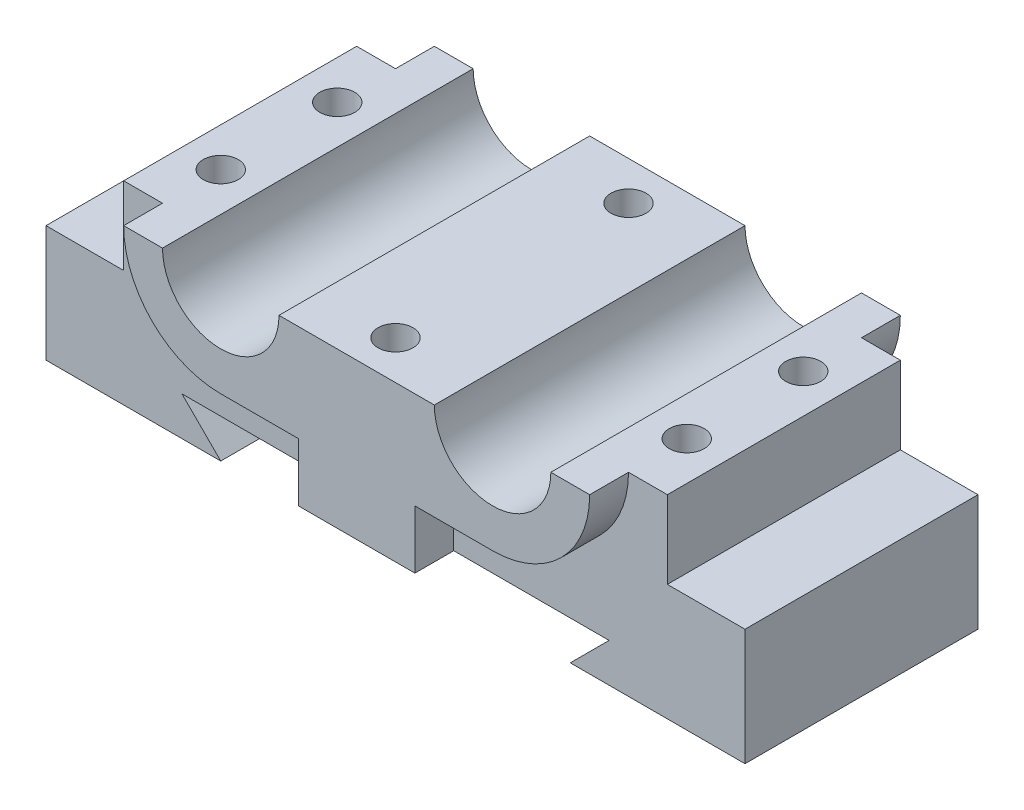
from build123d import *

# Parameters (mm, degrees)
SKETCH1_W           = 90
SKETCH1_H           = 40
BOSS_EXTRUDE1_DEPTH = 25
CUT_EXTRUDE1_REACH  = 67.192
SKETCH2_R           = 7.5
SKETCH2_W           = 10
SKETCH2_H           = 10
CUT_EXTRUDE2_DEPTH  = 5
CUT_EXTRUDE3_DEPTH  = 66.192024052
SKETCH5_R           = 2.25
CUT_EXTRUDE4_DEPTH  = 15


with BuildPart() as part:
    # Sketch1 → Boss-Extrude1 (new body)
    with BuildSketch(Plane(origin=(0, 0, 0), x_dir=(1, 0, 0), z_dir=(0, 1, 0))):
        Rectangle(SKETCH1_W, SKETCH1_H)
    extrude(amount=BOSS_EXTRUDE1_DEPTH)

    # Sketch2 → Cut-Extrude1 (cut, up to next)
    with BuildSketch(Plane.XY.offset(20), mode=Mode.PRIVATE) as cut_extrude1_sk1:
        with Locations((-17.5, 25)):
            Circle(SKETCH2_R)
    cut_extrude1_tool1 = extrude(cut_extrude1_sk1.sketch, amount=-CUT_EXTRUDE1_REACH, mode=Mode.PRIVATE) & part.part
    # Sketch2 → Cut-Extrude1 (cut, up to next)
    with BuildSketch(Plane.XY.offset(20), mode=Mode.PRIVATE) as cut_extrude1_sk2:
        with Locations((17.5, 25)):
            Circle(SKETCH2_R)
    cut_extrude1_tool2 = extrude(cut_extrude1_sk2.sketch, amount=-CUT_EXTRUDE1_REACH, mode=Mode.PRIVATE) & part.part
    # Sketch2 → Cut-Extrude1 (cut, up to next)
    with BuildSketch(Plane.XY.offset(20), mode=Mode.PRIVATE) as cut_extrude1_sk3:
        with Locations((40, 20)):
            Rectangle(SKETCH2_W, SKETCH2_H)
    cut_extrude1_tool3 = extrude(cut_extrude1_sk3.sketch, amount=-CUT_EXTRUDE1_REACH, mode=Mode.PRIVATE) & part.part
    # Sketch2 → Cut-Extrude1 (cut, up to next)
    with BuildSketch(Plane.XY.offset(20), mode=Mode.PRIVATE) as cut_extrude1_sk4:
        with Locations((-40, 20)):
            Rectangle(SKETCH2_W, SKETCH2_H)
    cut_extrude1_tool4 = extrude(cut_extrude1_sk4.sketch, amount=-CUT_EXTRUDE1_REACH, mode=Mode.PRIVATE) & part.part
    add(cut_extrude1_tool1.solids().sort_by_distance((-17.5, 25, 20))[0], mode=Mode.SUBTRACT)
    add(cut_extrude1_tool2.solids().sort_by_distance((17.5, 25, 20))[0], mode=Mode.SUBTRACT)
    add(cut_extrude1_tool3.solids().sort_by_distance((40, 20, 20))[0], mode=Mode.SUBTRACT)
    add(cut_extrude1_tool4.solids().sort_by_distance((-40, 20, 20))[0], mode=Mode.SUBTRACT)

    # Sketch3 → Cut-Extrude2 (cut)
    with BuildSketch(Plane.XY.offset(20)):
        with BuildLine():
            Line((-7.5, 12.5), (-7.5, 0))
            Line((-7.5, 0), (-45, 0))
            Line((-45, 0), (-45, 25))
            Line((-45, 25), (-30, 25))
            ThreePointArc((-30, 25), (-26.338834765, 16.161165235), (-17.5, 12.5))
            Line((-17.5, 12.5), (-7.5, 12.5))
        make_face()
        with BuildLine():
            Line((7.5, 12.5), (7.5, 0))
            Line((7.5, 0), (45, 0))
            Line((45, 0), (45, 25))
            Line((45, 25), (30, 25))
            ThreePointArc((30, 25), (26.338834765, 16.161165235), (17.5, 12.5))
            Line((17.5, 12.5), (7.5, 12.5))
        make_face()
    cut_extrude2 = extrude(amount=-CUT_EXTRUDE2_DEPTH, mode=Mode.SUBTRACT)

    # Mirror1: Cut-Extrude2 across plane
    add(cut_extrude2.mirror(Plane.XY), mode=Mode.SUBTRACT)

    # Sketch4 → Cut-Extrude3 (cut, through all)
    with BuildSketch(Plane.XY.offset(20)):
        Polygon((-27.5, 5), (27.5, 5), (22.5, 0), (-22.5, 0), align=None)
    extrude(amount=-CUT_EXTRUDE3_DEPTH, mode=Mode.SUBTRACT)

    # Sketch5 → Cut-Extrude4 (cut)
    with BuildSketch(Plane(origin=(0, 25, 0), x_dir=(1, 0, 0), z_dir=(0, 1, 0))):
        with Locations(Location((-30, 7.5, 0), (0, 0, 270))):
            Circle(SKETCH5_R)
        with Locations(Location((-30, -7.5, 0), (0, 0, 270))):
            Circle(SKETCH5_R)
        with Locations(Location((0, 15, 0), (0, 0, 270))):
            Circle(SKETCH5_R)
        with Locations(Location((0, -15, 0), (0, 0, 270))):
            Circle(SKETCH5_R)
        with Locations(Location((30, 7.5, 0), (0, 0, 270))):
            Circle(SKETCH5_R)
        with Locations(Location((30, -7.5, 0), (0, 0, 270))):
            Circle(SKETCH5_R)
    extrude(amount=-CUT_EXTRUDE4_DEPTH, mode=Mode.SUBTRACT)


solid = part.part
